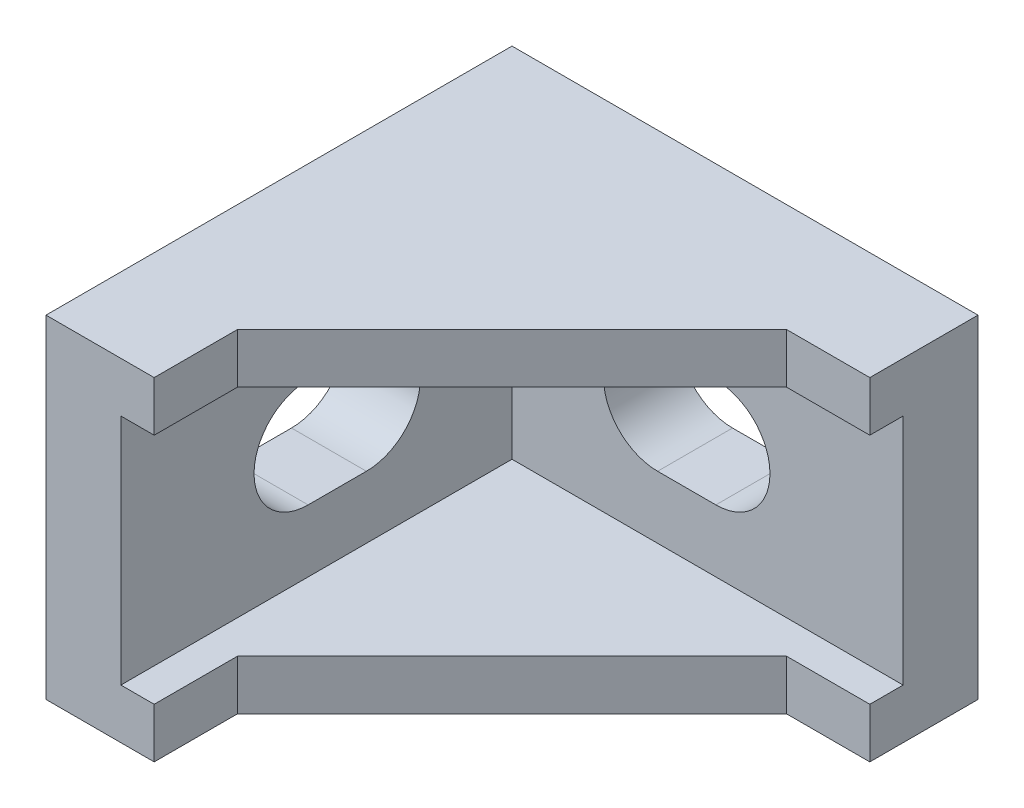
from build123d import *

# Parameters (mm, degrees)
SKETCH1_W           = 28
SKETCH1_H           = 20
BOSS_EXTRUDE1_DEPTH = 4.5
CUT_EXTRUDE1_DEPTH  = 22
BOSS_EXTRUDE3_DEPTH = 3


with BuildPart() as part:
    # Sketch1 → Boss-Extrude1 (new body)
    with BuildSketch(Plane.XY):
        Rectangle(SKETCH1_W, SKETCH1_H)
        with BuildLine():
            Line((-0.75, 3.25), (2.75, 3.25))
            ThreePointArc((2.75, 3.25), (6, 0), (2.75, -3.25))
            Line((2.75, -3.25), (-0.75, -3.25))
            ThreePointArc((-0.75, -3.25), (-4, 0), (-0.75, 3.25))
        make_face(mode=Mode.SUBTRACT)
    extrude(amount=BOSS_EXTRUDE1_DEPTH)

    # Sketch3 → Cut-Extrude1 (cut)
    with BuildSketch(Plane(origin=(0, -10, 0), x_dir=(-1, 0, 0), z_dir=(0, -1, 0))):
        Polygon((14, 0), (9.5, -4.5), (14, -4.5), align=None)
    extrude(amount=-CUT_EXTRUDE1_DEPTH, mode=Mode.SUBTRACT)

    # Sketch4 → Boss-Extrude3 (add)
    with BuildSketch(Plane(origin=(0, -10, 0), x_dir=(-1, 0, 0), z_dir=(0, -1, 0))):
        Polygon((-14, -4.5), (-14, -6.5), (-9, -6.5), (-0.75, -14.75), (9.5, -4.5), align=None)
    boss_extrude3 = extrude(amount=-BOSS_EXTRUDE3_DEPTH)

    # Mirror1: Boss-Extrude3 across plane
    add(boss_extrude3.mirror(Plane(origin=(0, 0, 0), x_dir=(0, 0, 1), z_dir=(0, -1, 0))))

    # Mirror2: part across plane


with BuildPart() as part_1:
    add(part.part)
    add(part.part.mirror(Plane(origin=(-14, 12, 0), x_dir=(0.7071067811865476, 0, 0.7071067811865476), z_dir=(0.7071067811865477, 0, -0.7071067811865475))))


solid = part_1.part
